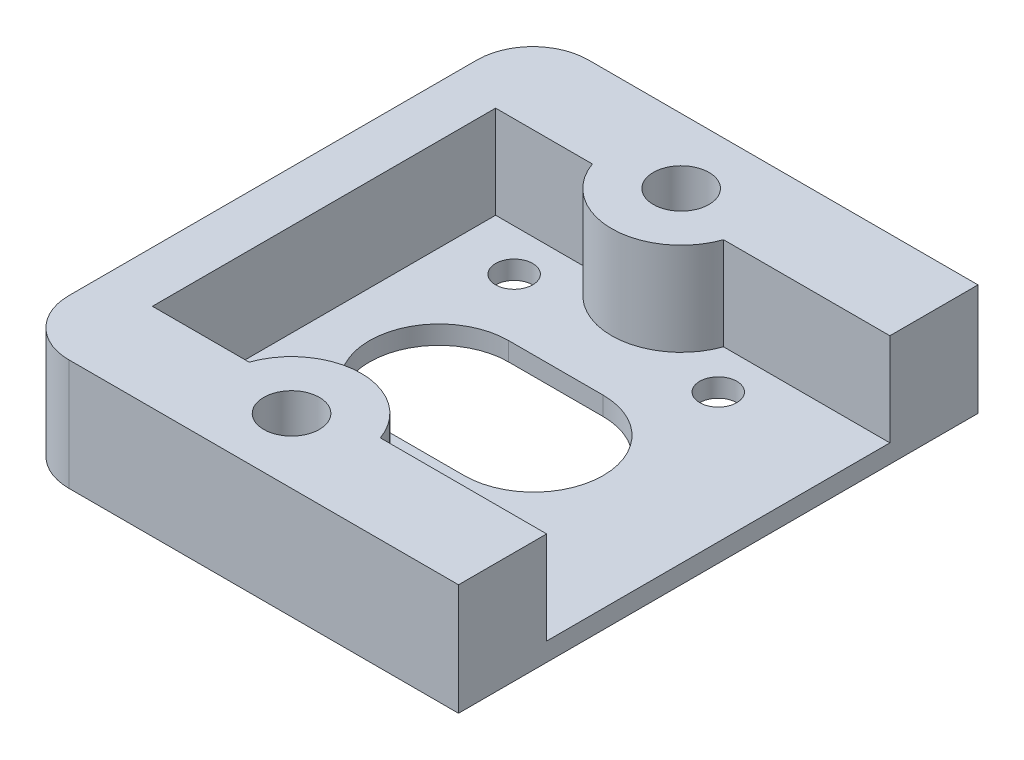
from build123d import *

# Parameters (mm, degrees)
SKETCH_1_W          = 24
SKETCH_1_H          = 28
EXTRUDE_1_DEPTH     = 6
SKETCH_2_W          = 17.5
SKETCH_2_H          = 18.5
CUT_EXTRUDE_3_DEPTH = 5
SKETCH_4_R          = 1
CUT_EXTRUDE_4_DEPTH = 5
SKETCH_5_W          = 3.75
SKETCH_5_H          = 18.5
CUT_EXTRUDE_5_DEPTH = 5
FILLET_1_R          = 3
SKETCH_7_R          = 1.5
EXTRUDE_4_DEPTH     = 6
SKETCH_12_R         = 1.5
CUT_EXTRUDE_6_DEPTH = 10


with BuildPart() as part:
    # 草图1 → 凸台-拉伸1 (new body)
    with BuildSketch(Plane(origin=(0, 0, 0), x_dir=(1, 0, 0), z_dir=(0, 1, 0))):
        with Locations((12, -14)):
            Rectangle(SKETCH_1_W, SKETCH_1_H)
    extrude(amount=EXTRUDE_1_DEPTH)

    # 草图2 → 切除-拉伸3 (cut)
    with BuildSketch(Plane(origin=(0, 6, 0), x_dir=(1, 0, 0), z_dir=(0, 1, 0))):
        with Locations((11.5, -14)):
            Rectangle(SKETCH_2_W, SKETCH_2_H)
    extrude(amount=-CUT_EXTRUDE_3_DEPTH, mode=Mode.SUBTRACT)

    # 草图4 → 切除-拉伸4 (cut)
    with BuildSketch(Plane(origin=(0, 1, 0), x_dir=(1, 0, 0), z_dir=(0, 1, 0))):
        with Locations(Location((6, -7, 0), (0, 0, 270))):
            Circle(SKETCH_4_R)
        with Locations(Location((17, -7, 0), (0, 0, 270))):
            Circle(SKETCH_4_R)
        with Locations(Location((6, -21, 0), (0, 0, 270))):
            Circle(SKETCH_4_R)
        with Locations(Location((17, -21, 0), (0, 0, 270))):
            Circle(SKETCH_4_R)
        with BuildLine():
            Line((8.95, -10.25), (14.05, -10.25))
            ThreePointArc((14.05, -10.25), (17.8, -14), (14.05, -17.75))
            Line((14.05, -17.75), (8.95, -17.75))
            ThreePointArc((8.95, -17.75), (5.2, -14), (8.95, -10.25))
        make_face()
    extrude(amount=-CUT_EXTRUDE_4_DEPTH, mode=Mode.SUBTRACT)

    # 草图5 → 切除-拉伸5 (cut)
    with BuildSketch(Plane(origin=(0, 6, 0), x_dir=(1, 0, 0), z_dir=(0, 1, 0))):
        with Locations((22.125, -14)):
            Rectangle(SKETCH_5_W, SKETCH_5_H)
    extrude(amount=-CUT_EXTRUDE_5_DEPTH, mode=Mode.SUBTRACT)

    # 圆角1
    fillet_1_edges = [part.edges().sort_by_distance(p)[0] for p in [
        (0, 3, 0),
        (0, 3, 28),
    ]]
    fillet(fillet_1_edges, radius=FILLET_1_R)

    # 草图7 → 凸台-拉伸4 (add)
    # profile 1 of 2: a face of its own
    with BuildSketch(Plane(origin=(0, 6, 0), x_dir=(1, 0, 0), z_dir=(0, 1, 0))):
        with BuildLine():
            Line((12.846291202, 0), (10.153708798, 0))
            ThreePointArc((10.153708798, 0), (11.5, -7.25), (12.846291202, 0))
        make_face()
        with Locations((11.5, -3.5)):
            Circle(SKETCH_7_R, mode=Mode.SUBTRACT)
    # profile 2 of 2: a face of its own
    with BuildSketch(Plane(origin=(0, 6, 0), x_dir=(1, 0, 0), z_dir=(0, 1, 0))):
        with BuildLine():
            Line((12.846291202, -28), (10.153708798, -28))
            ThreePointArc((10.153708798, -28), (11.5, -20.75), (12.846291202, -28))
        make_face()
        with Locations((11.5, -24.5)):
            Circle(SKETCH_7_R, mode=Mode.SUBTRACT)
    extrude(amount=-EXTRUDE_4_DEPTH)

    # 草图12 → 切除-拉伸6 (cut)
    with BuildSketch(Plane(origin=(0, 6, 0), x_dir=(1, 0, 0), z_dir=(0, 1, 0))):
        with Locations(Location((11.5, -3.5, 0), (0, 0, 270))):
            Circle(SKETCH_12_R)
        with Locations(Location((11.5, -24.5, 0), (0, 0, 270))):
            Circle(SKETCH_12_R)
    extrude(amount=-CUT_EXTRUDE_6_DEPTH, mode=Mode.SUBTRACT)


solid = part.part
